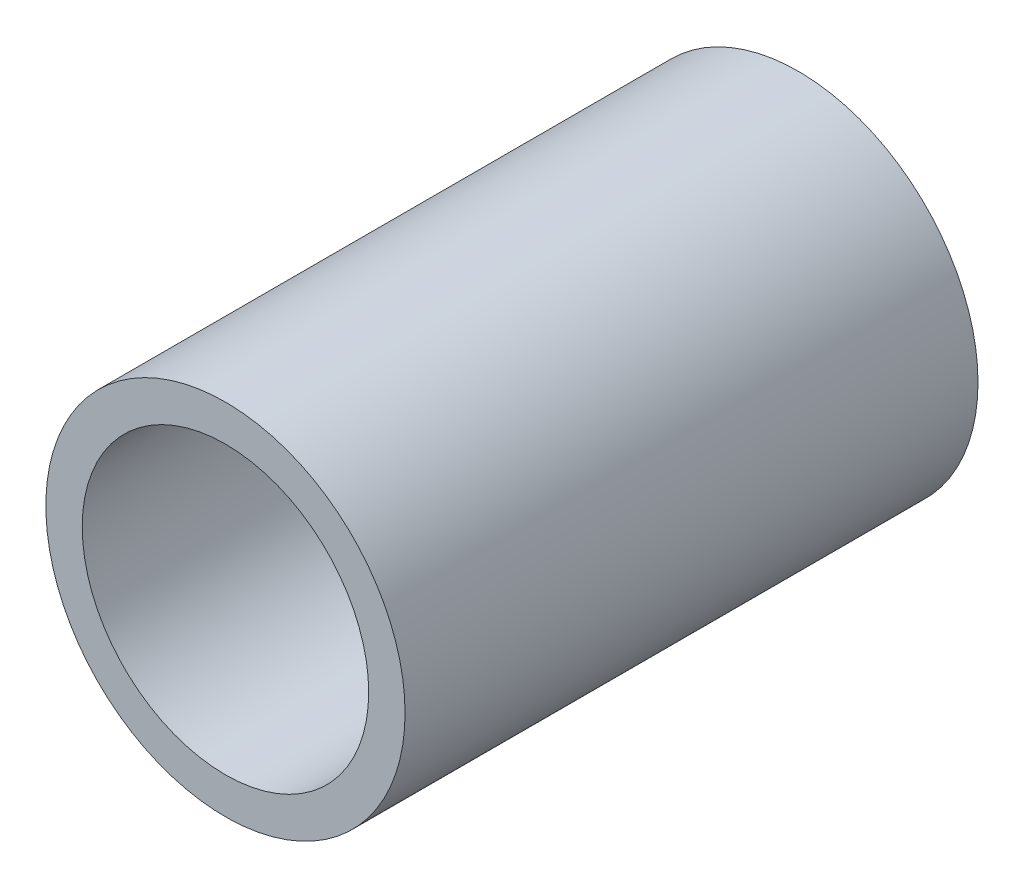
from build123d import *

# Parameters (mm, degrees)
SKETCH1_R      = 7.9629
SKETCH1_R_2    = 6.35
EXTRUDE1_DEPTH = 12.7


with BuildPart() as part:
    # Sketch1 → Extrude1 (new, symmetric)
    with BuildSketch(Plane.XY):
        Circle(SKETCH1_R)
        Circle(SKETCH1_R_2, mode=Mode.SUBTRACT)
    extrude(amount=EXTRUDE1_DEPTH, both=True)


solid = part.part
